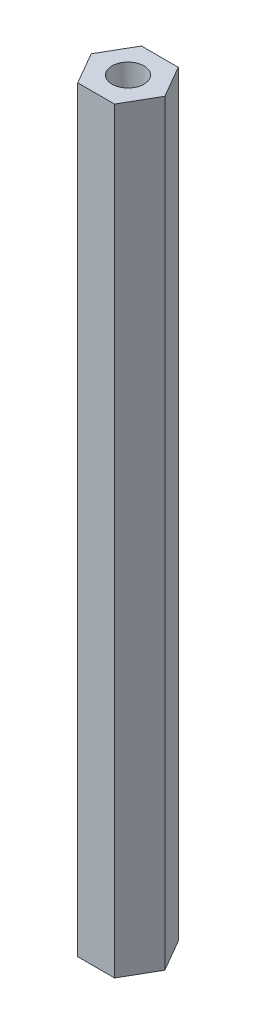
from build123d import *

# Parameters (mm, degrees)
BOSS_EXTRUDE1_DEPTH      = 47.498
BOSS_EXTRUDE1_DEPTH_BACK = 47.498
SKETCH3_R                = 2
CUT_EXTRUDE1_DEPTH       = 11.1
CUT_EXTRUDE2_START       = -10
SKETCH2_R                = 2
CUT_EXTRUDE2_DEPTH       = 10


with BuildPart() as part:
    # Sketch1 → Boss-Extrude1 (new, two sides: drawn at the far end of the back side and taken through both)
    with BuildSketch(Plane(origin=(0, 0, 0), x_dir=(1, 0, 0), z_dir=(0, 1, 0)).offset(-BOSS_EXTRUDE1_DEPTH_BACK)):
        Polygon((2.309401077, 4), (-2.309401077, 4), (-4.618802154, 0), (-2.309401077, -4), (2.309401077, -4), (4.618802154, 0), align=None)
    extrude(amount=BOSS_EXTRUDE1_DEPTH + BOSS_EXTRUDE1_DEPTH_BACK)

    # Sketch3 → Cut-Extrude1 (cut)
    with BuildSketch(Plane.XZ.offset(47.498)):
        Circle(SKETCH3_R)
    extrude(amount=-CUT_EXTRUDE1_DEPTH, mode=Mode.SUBTRACT)

    # Sketch2 → Cut-Extrude2 (cut)
    with BuildSketch(Plane(origin=(0, 47.498, 0), x_dir=(1, 0, 0), z_dir=(0, 1, 0)).offset(CUT_EXTRUDE2_START)):
        Circle(SKETCH2_R)
    extrude(amount=CUT_EXTRUDE2_DEPTH, mode=Mode.SUBTRACT)


solid = part.part
